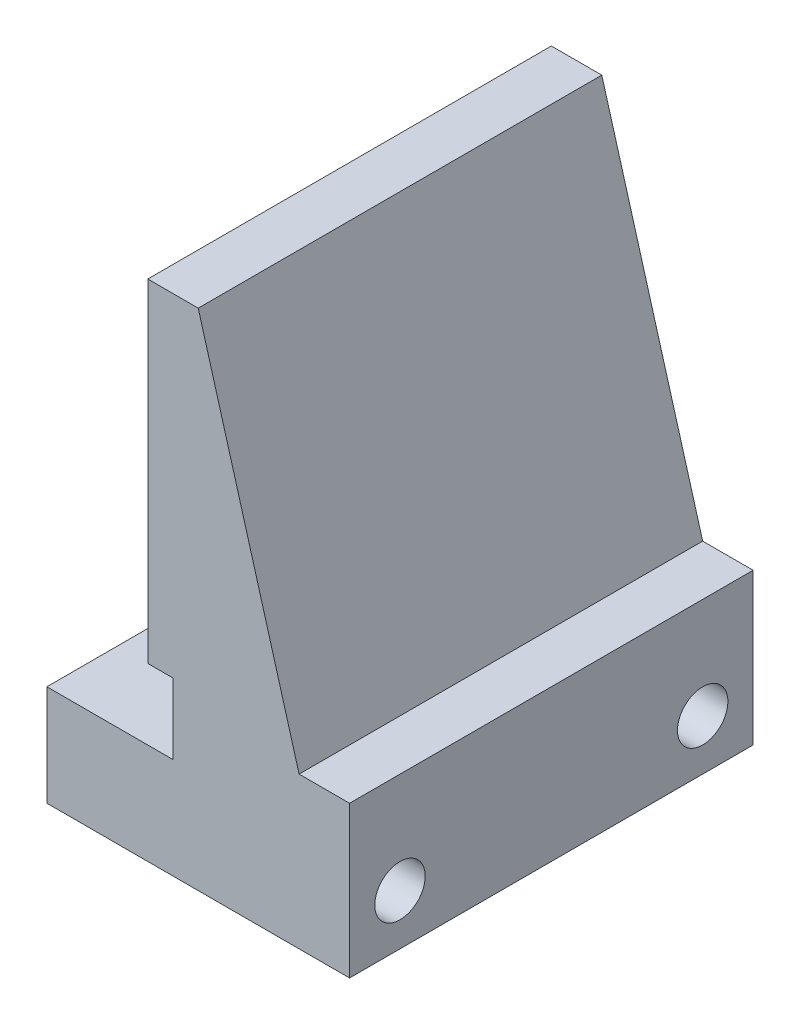
from build123d import *

# Parameters (mm, degrees)
BOSS_EXTRUDE2_DEPTH = 40
SKETCH7_R           = 2.5
CUT_EXTRUDE1_DEPTH  = 61.804276165
SKETCH8_R           = 0.75
BOSS_EXTRUDE3_DEPTH = 5


with BuildPart() as part:
    # Sketch1 → Boss-Extrude2 (new body)
    with BuildSketch(Plane.XY):
        Polygon((-4.44e-06, 34.6), (4.99999556, 34.6), (14.99999556, -0.4), (19.99999556, -0.4), (19.99999556, -5.4), (19.99999556, -15.4), (-1.2662e-05, -15.4), (-10.00000444, -15.4), (-10.00000444, -5.4), (-4.44e-06, -5.4), (2.49999556, -5.4), (2.49999556, 1.6), (-4.44e-06, 1.6), align=None)
    extrude(amount=BOSS_EXTRUDE2_DEPTH)

    # Sketch7 → Cut-Extrude1 (cut, through all)
    with BuildSketch(Plane(origin=(19.99999556, 0, 0), x_dir=(0, 0, -1), z_dir=(1, 0, 0))):
        with Locations((-35, -10.4)):
            Circle(SKETCH7_R)
        with Locations((-5, -10.4)):
            Circle(SKETCH7_R)
    extrude(amount=-CUT_EXTRUDE1_DEPTH, mode=Mode.SUBTRACT)

    # Sketch8 → Boss-Extrude3 (add)
    with BuildSketch(Plane(origin=(0, -5.4, 0), x_dir=(1, 0, 0), z_dir=(0, 1, 0))):
        with Locations(Location((-5.00000444, -20, 0), (0, 0, 90))):
            Circle(SKETCH8_R)
    extrude(amount=BOSS_EXTRUDE3_DEPTH)


solid = part.part
